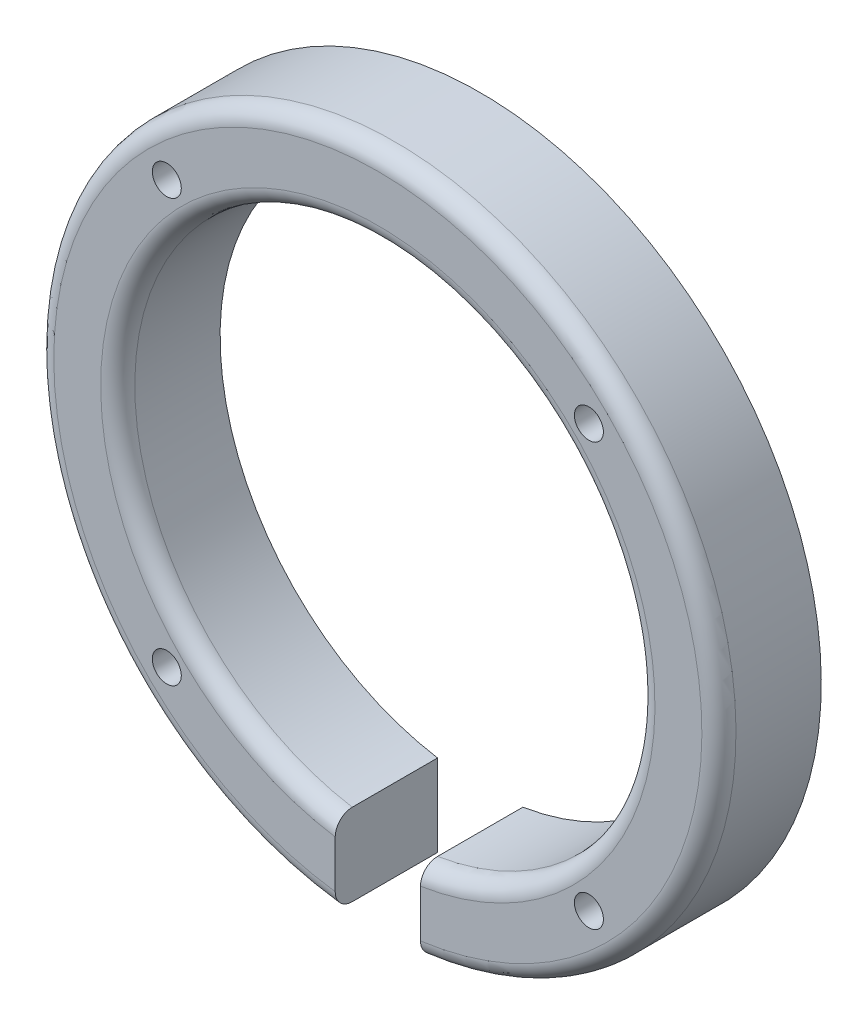
from build123d import *

# Parameters (mm, degrees)
SKETCH_1_R               = 40
SKETCH_1_R_2             = 30.5
EXTRUDE_1_DEPTH          = 12
SKETCH_2_R               = 1.7
CUT_EXTRUDE_1_DEPTH      = 12
FILLET_1_R               = 2
FILLET_2_R               = 2
CUT_EXTRUDE_2_DEPTH      = 10
CUT_EXTRUDE_2_DEPTH_BACK = 58.827329248
SKETCH_3_W               = 10
SKETCH_3_H               = 17.135936663


with BuildPart() as part:
    # 草图1 → 凸台-拉伸1 (new body)
    with BuildSketch(Plane.XY):
        Circle(SKETCH_1_R)
        Circle(SKETCH_1_R_2, mode=Mode.SUBTRACT)
    extrude(amount=EXTRUDE_1_DEPTH)

    # 草图2 → 切除-拉伸1 (cut)
    with BuildSketch(Plane.XY.offset(12)):
        with Locations((24.748737342, 24.748737342)):
            Circle(SKETCH_2_R)
        with Locations((24.748737342, -24.748737342)):
            Circle(SKETCH_2_R)
        with Locations((-24.748737342, -24.748737342)):
            Circle(SKETCH_2_R)
        with Locations((-24.748737342, 24.748737342)):
            Circle(SKETCH_2_R)
    extrude(amount=-CUT_EXTRUDE_1_DEPTH, mode=Mode.SUBTRACT)

    # 圆角1
    fillet_1_edges = [part.edges().sort_by_distance(p)[0] for p in [
        (-30.5, 0, 12),
    ]]
    fillet(fillet_1_edges, radius=FILLET_1_R)

    # 圆角2
    fillet_2_edges = [part.edges().sort_by_distance(p)[0] for p in [
        (-40, 0, 12),
    ]]
    fillet(fillet_2_edges, radius=FILLET_2_R)

    # 草图3 → 切除-拉伸2 (cut, two sides: drawn at the far end of the back side and taken through both)
    with BuildSketch(Plane(origin=(0, 0, 0), x_dir=(1, 0, 0), z_dir=(0, 1, 0)).offset(-CUT_EXTRUDE_2_DEPTH_BACK)):
        with Locations((0, -8.567968332)):
            Rectangle(SKETCH_3_W, SKETCH_3_H)
    extrude(amount=CUT_EXTRUDE_2_DEPTH + CUT_EXTRUDE_2_DEPTH_BACK, mode=Mode.SUBTRACT)


solid = part.part
